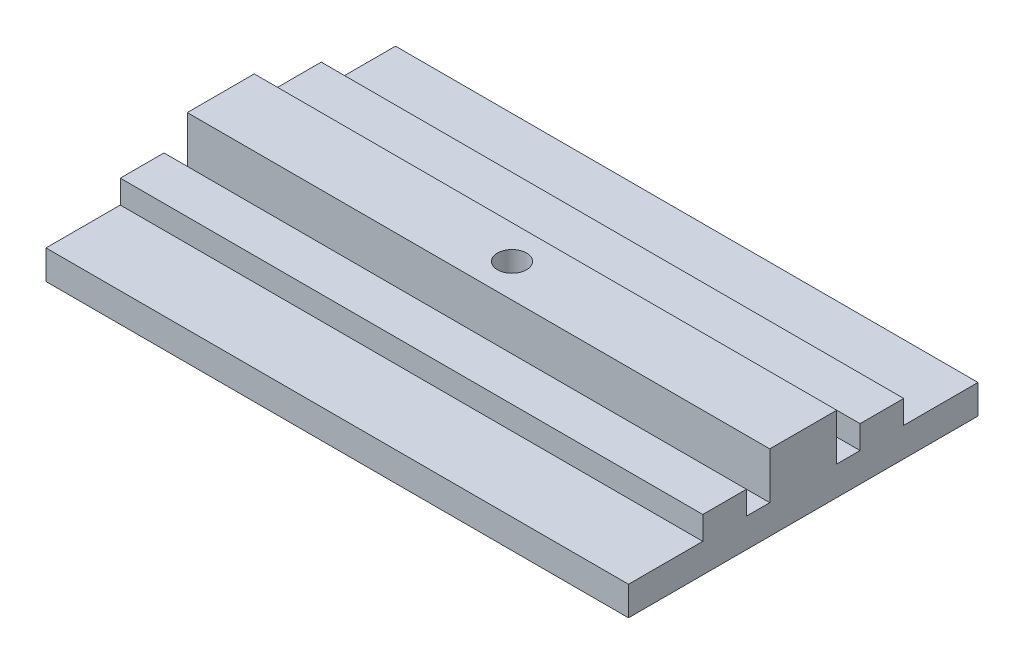
from build123d import *

# Parameters (mm, degrees)
SKETCH1_W               = 200
SKETCH1_H               = 120
BOSS_EXTRUDE1_DEPTH     = 10
SKETCH2_W               = 200
SKETCH2_H               = 15
BOSS_EXTRUDE2_DEPTH     = 8
SKETCH3_R               = 5
CUT_EXTRUDE1_DEPTH      = 118.046999107
SKETCH4_W               = 200
SKETCH4_H               = 23
BOSS_EXTRUDE4_DEPTH     = 16
CUT_EXTRUDE2_DEPTH      = 118.711511756
CUT_EXTRUDE2_DEPTH_BACK = 118.711511756
SKETCH3_2_R             = 5


with BuildPart() as part:
    # Sketch1 → Boss-Extrude1 (new body)
    with BuildSketch(Plane(origin=(0, 0, 0), x_dir=(1, 0, 0), z_dir=(0, 1, 0))):
        Rectangle(SKETCH1_W, SKETCH1_H)
    extrude(amount=BOSS_EXTRUDE1_DEPTH)

    # Sketch2 → Boss-Extrude2 (add)
    with BuildSketch(Plane(origin=(0, 10, 0), x_dir=(1, 0, 0), z_dir=(0, 1, 0))):
        with Locations((0, 26.999)):
            Rectangle(SKETCH2_W, SKETCH2_H)
        with Locations((0, -26.999)):
            Rectangle(SKETCH2_W, SKETCH2_H)
    extrude(amount=BOSS_EXTRUDE2_DEPTH)

    # Sketch3 → Cut-Extrude1 (cut, through all)
    with BuildSketch(Plane(origin=(0, 10, 0), x_dir=(1, 0, 0), z_dir=(0, 1, 0))):
        Circle(SKETCH3_R)
    extrude(amount=-CUT_EXTRUDE1_DEPTH, mode=Mode.SUBTRACT)

    # Sketch4 → Boss-Extrude4 (add)
    with BuildSketch(Plane(origin=(0, 10, 0), x_dir=(1, 0, 0), z_dir=(0, 1, 0))):
        Rectangle(SKETCH4_W, SKETCH4_H)
    extrude(amount=BOSS_EXTRUDE4_DEPTH)

    # Sketch3<2> → Cut-Extrude2 (cut, two sides: drawn at the far end of the back side and taken through both)
    with BuildSketch(Plane(origin=(0, 10, 0), x_dir=(1, 0, 0), z_dir=(0, 1, 0)).offset(-CUT_EXTRUDE2_DEPTH_BACK)):
        Circle(SKETCH3_2_R)
    extrude(amount=CUT_EXTRUDE2_DEPTH + CUT_EXTRUDE2_DEPTH_BACK, mode=Mode.SUBTRACT)


solid = part.part
